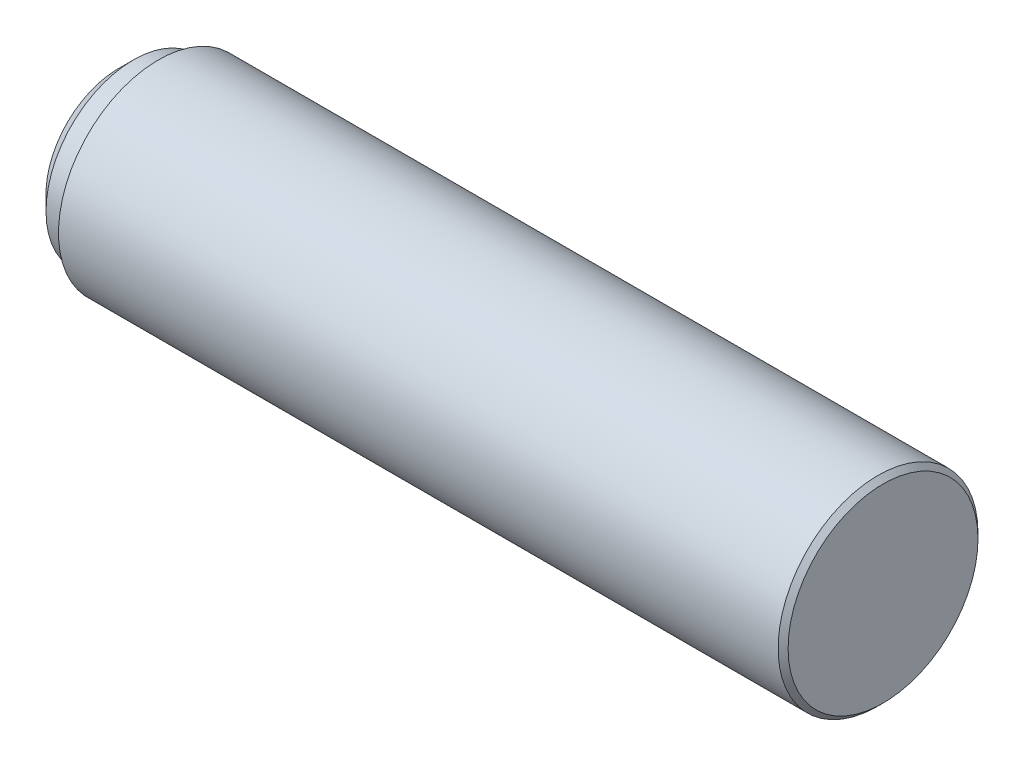
from build123d import *

# Parameters (mm, degrees)
SKETCH_1_R      = 20
EXTRUDE_1_DEPTH = 145
SKETCH_2_R      = 17.5
EXTRUDE_2_DEPTH = 8
CHAMFER_2_SIZE  = 3
CHAMFER_1_SIZE  = 1


with BuildPart() as part:
    # 草图1 → 凸台-拉伸1 (new body)
    with BuildSketch(Plane(origin=(0, 0, 0), x_dir=(0, 0, -1), z_dir=(1, 0, 0))):
        Circle(SKETCH_1_R)
    extrude(amount=EXTRUDE_1_DEPTH)

    # 草图2 → 凸台-拉伸2 (add)
    with BuildSketch(Plane.ZY):
        Circle(SKETCH_2_R)
    extrude(amount=EXTRUDE_2_DEPTH)

    # 倒角2
    chamfer_2_edges = [part.edges().sort_by_distance(p)[0] for p in [
        (-8, 0, -17.5),
    ]]
    chamfer(chamfer_2_edges, length=CHAMFER_2_SIZE)

    # 倒角1
    chamfer_1_edges = [part.edges().sort_by_distance(p)[0] for p in [
        (145, 0, 20),
    ]]
    chamfer(chamfer_1_edges, length=CHAMFER_1_SIZE)


solid = part.part
